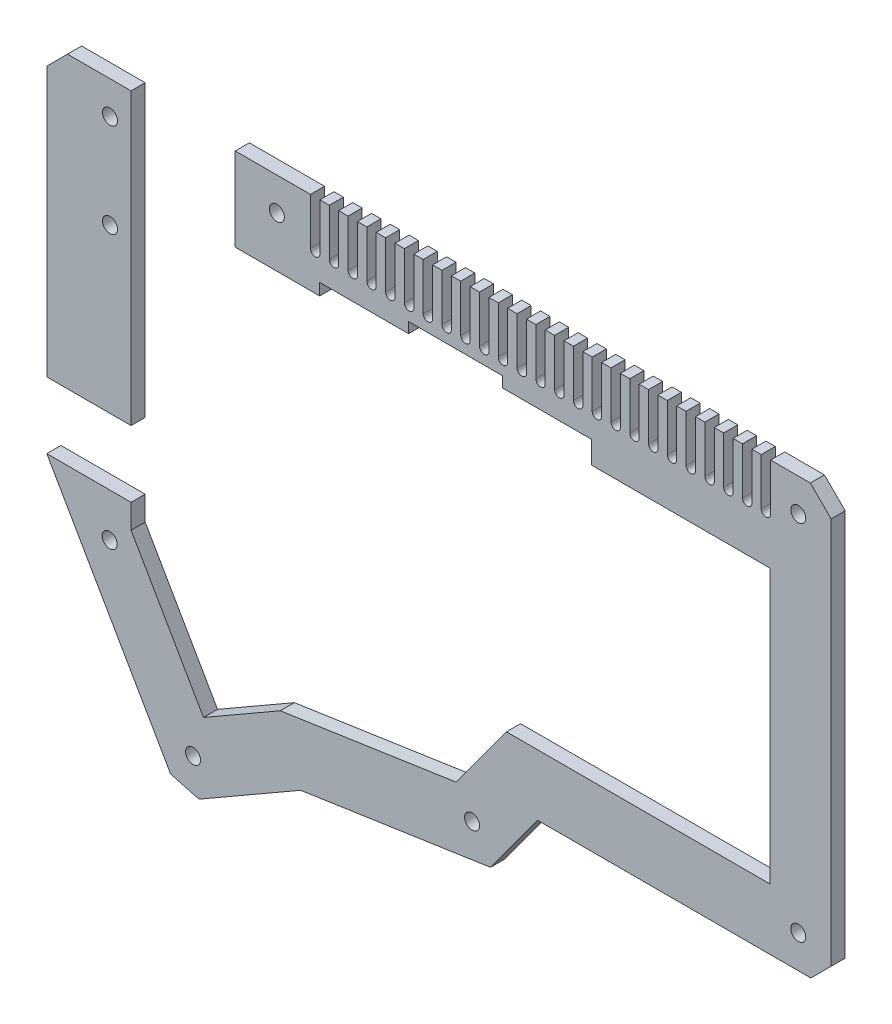
from build123d import *

# Parameters (mm, degrees)
ESQUISSE1_R             = 1.6
BOSS_EXTRU_1_DEPTH      = 3
ENL_V_MAT_EXTRU_1_DEPTH = 10
ESQUISSE3_W             = 19.456160795
ESQUISSE3_H             = 14.150463698
ENL_V_MAT_EXTRU_2_DEPTH = 10


with BuildPart() as part:
    # Esquisse1 → Boss.-Extru.1 (new body)
    with BuildSketch(Plane.XY):
        Polygon((-119.346315028, 5.320852512), (-119.346315028, 1.570515597), (-119.346382005, -12.429484403), (-101.345774335, -12.429484403), (-101.345774335, -9.929307079), (-82.434988213, -9.929307079), (-82.434988213, -7.679926158), (-62.433711482, -7.681038584), (-62.433711482, -9.929307079), (-43.432363825, -9.929307079), (-43.432363825, -14.679643994), (-5.429668504, -14.679643994), (-5.429668504, -72.933633781), (-61.577157206, -72.933633781), (-72.263087593, -87.572177036), (-109.761976756, -93.1463556), (-126.111124489, -102.556497988), (-141.52282508, -75.732017442), (-141.52282508, 5.320852512), (-155.064772313, 5.320852512), (-159.478985875, 0.90663895), (-159.478985875, -70.574320891), (-133.100653393, -116.486520024), (-127.076613358, -118.11178196), (-105.412894174, -105.642711064), (-64.97062335, -99.631001274), (-54.971738012, -85.933633781), (3.246679477, -85.933633781), (7.570331496, -81.609981762), (7.570331496, 0.900815081), (3.15053989, 5.320852512), align=None)
        with Locations((-146.02282508, -21.680525068)):
            Circle(ESQUISSE1_R, mode=Mode.SUBTRACT)
        with Locations((0.570331496, -1.684542717)):
            Circle(ESQUISSE1_R, mode=Mode.SUBTRACT)
        with Locations((-110.487646531, -1.678365923)):
            Circle(ESQUISSE1_R, mode=Mode.SUBTRACT)
        with Locations((-146.02282508, -1.677868186)):
            Circle(ESQUISSE1_R, mode=Mode.SUBTRACT)
        with Locations((-146.0923789, -79.822656053)):
            Circle(ESQUISSE1_R, mode=Mode.SUBTRACT)
        with Locations((-128.322250168, -110.752044388)):
            Circle(ESQUISSE1_R, mode=Mode.SUBTRACT)
        with Locations((-68.897334865, -93.137788223)):
            Circle(ESQUISSE1_R, mode=Mode.SUBTRACT)
        with Locations((0.570331496, -78.933633781)):
            Circle(ESQUISSE1_R, mode=Mode.SUBTRACT)
    extrude(amount=BOSS_EXTRU_1_DEPTH)

    # Esquisse2 → Enlèv. mat.-Extru.1 (cut)
    with BuildSketch(Plane.XY.offset(3)):
        with BuildLine():
            Line((-5.315456398, 8.615924369), (-5.315456398, -4.679147488))
            ThreePointArc((-5.315456398, -4.679147488), (-6.315456398, -5.679147488), (-7.315456398, -4.679147488))
            Line((-7.315456398, -4.679147488), (-7.315456398, 8.615924369))
            ThreePointArc((-7.315456398, 8.615924369), (-6.315456398, 9.615924369), (-5.315456398, 8.615924369))
        make_face()
        with BuildLine():
            Line((-9.315456398, 8.615924369), (-9.315456398, -4.679147488))
            ThreePointArc((-9.315456398, -4.679147488), (-10.315456398, -5.679147488), (-11.315456398, -4.679147488))
            Line((-11.315456398, -4.679147488), (-11.315456398, 8.615924369))
            ThreePointArc((-11.315456398, 8.615924369), (-10.315456398, 9.615924369), (-9.315456398, 8.615924369))
        make_face()
        with BuildLine():
            Line((-13.315456398, 8.615924369), (-13.315456398, -4.679147488))
            ThreePointArc((-13.315456398, -4.679147488), (-14.315456398, -5.679147488), (-15.315456398, -4.679147488))
            Line((-15.315456398, -4.679147488), (-15.315456398, 8.615924369))
            ThreePointArc((-15.315456398, 8.615924369), (-14.315456398, 9.615924369), (-13.315456398, 8.615924369))
        make_face()
        with BuildLine():
            Line((-17.315456398, 8.615924369), (-17.315456398, -4.679147488))
            ThreePointArc((-17.315456398, -4.679147488), (-18.315456398, -5.679147488), (-19.315456398, -4.679147488))
            Line((-19.315456398, -4.679147488), (-19.315456398, 8.615924369))
            ThreePointArc((-19.315456398, 8.615924369), (-18.315456398, 9.615924369), (-17.315456398, 8.615924369))
        make_face()
        with BuildLine():
            Line((-21.315456398, 8.615924369), (-21.315456398, -4.679147488))
            ThreePointArc((-21.315456398, -4.679147488), (-22.315456398, -5.679147488), (-23.315456398, -4.679147488))
            Line((-23.315456398, -4.679147488), (-23.315456398, 8.615924369))
            ThreePointArc((-23.315456398, 8.615924369), (-22.315456398, 9.615924369), (-21.315456398, 8.615924369))
        make_face()
        with BuildLine():
            Line((-25.315456398, 8.615924369), (-25.315456398, -4.679147488))
            ThreePointArc((-25.315456398, -4.679147488), (-26.315456398, -5.679147488), (-27.315456398, -4.679147488))
            Line((-27.315456398, -4.679147488), (-27.315456398, 8.615924369))
            ThreePointArc((-27.315456398, 8.615924369), (-26.315456398, 9.615924369), (-25.315456398, 8.615924369))
        make_face()
        with BuildLine():
            Line((-29.315456398, 8.615924369), (-29.315456398, -4.679147488))
            ThreePointArc((-29.315456398, -4.679147488), (-30.315456398, -5.679147488), (-31.315456398, -4.679147488))
            Line((-31.315456398, -4.679147488), (-31.315456398, 8.615924369))
            ThreePointArc((-31.315456398, 8.615924369), (-30.315456398, 9.615924369), (-29.315456398, 8.615924369))
        make_face()
        with BuildLine():
            Line((-33.315456398, 8.615924369), (-33.315456398, -4.679147488))
            ThreePointArc((-33.315456398, -4.679147488), (-34.315456398, -5.679147488), (-35.315456398, -4.679147488))
            Line((-35.315456398, -4.679147488), (-35.315456398, 8.615924369))
            ThreePointArc((-35.315456398, 8.615924369), (-34.315456398, 9.615924369), (-33.315456398, 8.615924369))
        make_face()
        with BuildLine():
            Line((-37.315456398, 8.615924369), (-37.315456398, -4.679147488))
            ThreePointArc((-37.315456398, -4.679147488), (-38.315456398, -5.679147488), (-39.315456398, -4.679147488))
            Line((-39.315456398, -4.679147488), (-39.315456398, 8.615924369))
            ThreePointArc((-39.315456398, 8.615924369), (-38.315456398, 9.615924369), (-37.315456398, 8.615924369))
        make_face()
        with BuildLine():
            Line((-41.315456398, 8.615924369), (-41.315456398, -4.679147488))
            ThreePointArc((-41.315456398, -4.679147488), (-42.315456398, -5.679147488), (-43.315456398, -4.679147488))
            Line((-43.315456398, -4.679147488), (-43.315456398, 8.615924369))
            ThreePointArc((-43.315456398, 8.615924369), (-42.315456398, 9.615924369), (-41.315456398, 8.615924369))
        make_face()
        with BuildLine():
            Line((-45.315456398, 8.615924369), (-45.315456398, -4.679147488))
            ThreePointArc((-45.315456398, -4.679147488), (-46.315456398, -5.679147488), (-47.315456398, -4.679147488))
            Line((-47.315456398, -4.679147488), (-47.315456398, 8.615924369))
            ThreePointArc((-47.315456398, 8.615924369), (-46.315456398, 9.615924369), (-45.315456398, 8.615924369))
        make_face()
        with BuildLine():
            Line((-49.315456398, 8.615924369), (-49.315456398, -4.679147488))
            ThreePointArc((-49.315456398, -4.679147488), (-50.315456398, -5.679147488), (-51.315456398, -4.679147488))
            Line((-51.315456398, -4.679147488), (-51.315456398, 8.615924369))
            ThreePointArc((-51.315456398, 8.615924369), (-50.315456398, 9.615924369), (-49.315456398, 8.615924369))
        make_face()
        with BuildLine():
            Line((-53.315456398, 8.615924369), (-53.315456398, -4.679147488))
            ThreePointArc((-53.315456398, -4.679147488), (-54.315456398, -5.679147488), (-55.315456398, -4.679147488))
            Line((-55.315456398, -4.679147488), (-55.315456398, 8.615924369))
            ThreePointArc((-55.315456398, 8.615924369), (-54.315456398, 9.615924369), (-53.315456398, 8.615924369))
        make_face()
        with BuildLine():
            Line((-57.315456398, 8.615924369), (-57.315456398, -4.679147488))
            ThreePointArc((-57.315456398, -4.679147488), (-58.315456398, -5.679147488), (-59.315456398, -4.679147488))
            Line((-59.315456398, -4.679147488), (-59.315456398, 8.615924369))
            ThreePointArc((-59.315456398, 8.615924369), (-58.315456398, 9.615924369), (-57.315456398, 8.615924369))
        make_face()
        with BuildLine():
            Line((-61.315456398, 8.615924369), (-61.315456398, -4.679147488))
            ThreePointArc((-61.315456398, -4.679147488), (-62.315456398, -5.679147488), (-63.315456398, -4.679147488))
            Line((-63.315456398, -4.679147488), (-63.315456398, 8.615924369))
            ThreePointArc((-63.315456398, 8.615924369), (-62.315456398, 9.615924369), (-61.315456398, 8.615924369))
        make_face()
        with BuildLine():
            Line((-65.315456398, 8.615924369), (-65.315456398, -4.679147488))
            ThreePointArc((-65.315456398, -4.679147488), (-66.315456398, -5.679147488), (-67.315456398, -4.679147488))
            Line((-67.315456398, -4.679147488), (-67.315456398, 8.615924369))
            ThreePointArc((-67.315456398, 8.615924369), (-66.315456398, 9.615924369), (-65.315456398, 8.615924369))
        make_face()
        with BuildLine():
            Line((-69.315456398, 8.615924369), (-69.315456398, -4.679147488))
            ThreePointArc((-69.315456398, -4.679147488), (-70.315456398, -5.679147488), (-71.315456398, -4.679147488))
            Line((-71.315456398, -4.679147488), (-71.315456398, 8.615924369))
            ThreePointArc((-71.315456398, 8.615924369), (-70.315456398, 9.615924369), (-69.315456398, 8.615924369))
        make_face()
        with BuildLine():
            Line((-73.315456398, 8.615924369), (-73.315456398, -4.679147488))
            ThreePointArc((-73.315456398, -4.679147488), (-74.315456398, -5.679147488), (-75.315456398, -4.679147488))
            Line((-75.315456398, -4.679147488), (-75.315456398, 8.615924369))
            ThreePointArc((-75.315456398, 8.615924369), (-74.315456398, 9.615924369), (-73.315456398, 8.615924369))
        make_face()
        with BuildLine():
            Line((-77.315456398, 8.615924369), (-77.315456398, -4.679147488))
            ThreePointArc((-77.315456398, -4.679147488), (-78.315456398, -5.679147488), (-79.315456398, -4.679147488))
            Line((-79.315456398, -4.679147488), (-79.315456398, 8.615924369))
            ThreePointArc((-79.315456398, 8.615924369), (-78.315456398, 9.615924369), (-77.315456398, 8.615924369))
        make_face()
        with BuildLine():
            Line((-81.315456398, 8.615924369), (-81.315456398, -4.679147488))
            ThreePointArc((-81.315456398, -4.679147488), (-82.315456398, -5.679147488), (-83.315456398, -4.679147488))
            Line((-83.315456398, -4.679147488), (-83.315456398, 8.615924369))
            ThreePointArc((-83.315456398, 8.615924369), (-82.315456398, 9.615924369), (-81.315456398, 8.615924369))
        make_face()
        with BuildLine():
            Line((-85.315456398, 8.615924369), (-85.315456398, -4.679147488))
            ThreePointArc((-85.315456398, -4.679147488), (-86.315456398, -5.679147488), (-87.315456398, -4.679147488))
            Line((-87.315456398, -4.679147488), (-87.315456398, 8.615924369))
            ThreePointArc((-87.315456398, 8.615924369), (-86.315456398, 9.615924369), (-85.315456398, 8.615924369))
        make_face()
        with BuildLine():
            Line((-89.315456398, 8.615924369), (-89.315456398, -4.679147488))
            ThreePointArc((-89.315456398, -4.679147488), (-90.315456398, -5.679147488), (-91.315456398, -4.679147488))
            Line((-91.315456398, -4.679147488), (-91.315456398, 8.615924369))
            ThreePointArc((-91.315456398, 8.615924369), (-90.315456398, 9.615924369), (-89.315456398, 8.615924369))
        make_face()
        with BuildLine():
            Line((-93.315456398, 8.615924369), (-93.315456398, -4.679147488))
            ThreePointArc((-93.315456398, -4.679147488), (-94.315456398, -5.679147488), (-95.315456398, -4.679147488))
            Line((-95.315456398, -4.679147488), (-95.315456398, 8.615924369))
            ThreePointArc((-95.315456398, 8.615924369), (-94.315456398, 9.615924369), (-93.315456398, 8.615924369))
        make_face()
        with BuildLine():
            Line((-97.315456398, 8.615924369), (-97.315456398, -4.679147488))
            ThreePointArc((-97.315456398, -4.679147488), (-98.315456398, -5.679147488), (-99.315456398, -4.679147488))
            Line((-99.315456398, -4.679147488), (-99.315456398, 8.615924369))
            ThreePointArc((-99.315456398, 8.615924369), (-98.315456398, 9.615924369), (-97.315456398, 8.615924369))
        make_face()
        with BuildLine():
            Line((-101.315456398, 8.615924369), (-101.315456398, -4.679147488))
            ThreePointArc((-101.315456398, -4.679147488), (-102.315456398, -5.679147488), (-103.315456398, -4.679147488))
            Line((-103.315456398, -4.679147488), (-103.315456398, 8.615924369))
            ThreePointArc((-103.315456398, 8.615924369), (-102.315456398, 9.615924369), (-101.315456398, 8.615924369))
        make_face()
    extrude(amount=-ENL_V_MAT_EXTRU_1_DEPTH, mode=Mode.SUBTRACT)

    # Esquisse3 → Enlèv. mat.-Extru.2 (cut)
    with BuildSketch(Plane.XY.offset(3)):
        with Locations((-149.750905477, -63.499089042)):
            Rectangle(ESQUISSE3_W, ESQUISSE3_H)
    extrude(amount=-ENL_V_MAT_EXTRU_2_DEPTH, mode=Mode.SUBTRACT)


with BuildPart() as enl_v_mat_extru_2_piece_1:
    # of the separate pieces the step leaves, piece 1, a body of its own (enl_v_mat_extru_2_pieces)
    add(part.part.solids().sort_by_distance((7.570331496, 0.900815081, 0))[0])


with BuildPart() as enl_v_mat_extru_2_piece_2:
    # of the separate pieces the step leaves, piece 2, a body of its own (enl_v_mat_extru_2_pieces)
    add(part.part.solids().sort_by_distance((-159.478985875, 0.90663895, 0))[0])


solid = Compound([enl_v_mat_extru_2_piece_1.part, enl_v_mat_extru_2_piece_2.part])
